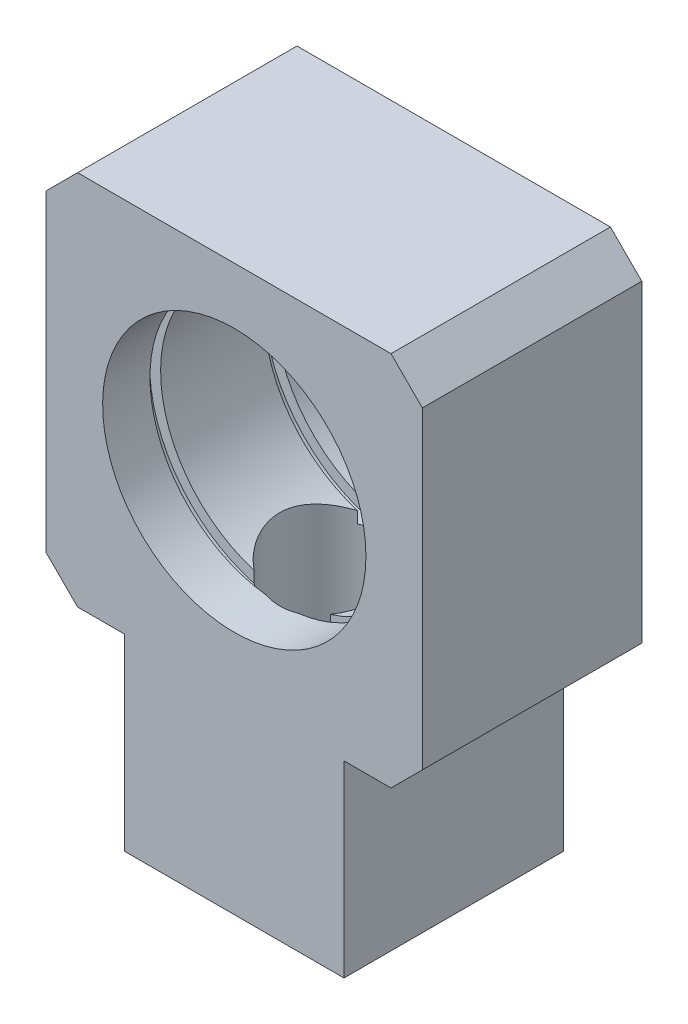
from build123d import *

# Parameters (mm, degrees)
SKETCH_1_R          = 30
SKETCH_1_R_2        = 21
EXTRUDE_1_DEPTH     = 17.5
M22X1_5_1_D         = 20.5
M22X1_5_1_DEPTH     = 48.5
M22X1_5_1_TIP       = 6.158821345
CUT_EXTRUDE_START   = 8.25
SKETCH_5_R          = 22.75
SKETCH_5_R_2        = 21
CUT_EXTRUDE_1_DEPTH = 1.7
CHAMFER_1_SIZE      = 5


with BuildPart() as part:
    # 草图1 → 凸台-拉伸1 (new, symmetric)
    # profile 1 of 8: a face of its own
    with BuildSketch(Plane.XY):
        with BuildLine():
            Line((30, 30), (2.9e-08, 30))
            ThreePointArc((2.9e-08, 30), (21.213203446, 21.213203425), (30, 0))
            Line((30, 0), (30, 30))
        make_face()
    # profile 2 of 8: a face of its own
    with BuildSketch(Plane.XY):
        with BuildLine():
            Line((-30, 30), (-30, 0))
            ThreePointArc((-30, 0), (-21.213203425, 21.213203446), (2.9e-08, 30))
            Line((2.9e-08, 30), (-30, 30))
        make_face()
    # profile 3 of 8: a face of its own
    with BuildSketch(Plane.XY):
        Circle(SKETCH_1_R)
        Circle(SKETCH_1_R_2, mode=Mode.SUBTRACT)
    # profile 4 of 8: a face of its own
    with BuildSketch(Plane.XY):
        with BuildLine():
            Line((17.5, -24.366985862), (17.5, -30))
            Line((17.5, -30), (30, -30))
            Line((30, -30), (30, 0))
            ThreePointArc((30, 0), (26.69269563, -13.693063938), (17.5, -24.366985862))
        make_face()
    # profile 5 of 8: a face of its own
    with BuildSketch(Plane.XY):
        with BuildLine():
            ThreePointArc((17.5, -24.366985862), (9.192127723, -28.557044454), (0, -30))
            Line((0, -30), (17.5, -30))
            Line((17.5, -30), (17.5, -24.366985862))
        make_face()
    # profile 6 of 8: a face of its own
    with BuildSketch(Plane.XY):
        with BuildLine():
            ThreePointArc((0, -30), (-9.192127723, -28.557044454), (-17.5, -24.366985862))
            Line((-17.5, -24.366985862), (-17.5, -30))
            Line((-17.5, -30), (0, -30))
        make_face()
    # profile 7 of 8: a face of its own
    with BuildSketch(Plane.XY):
        with BuildLine():
            Line((-17.5, -30), (-17.5, -24.366985862))
            ThreePointArc((-17.5, -24.366985862), (-26.69269563, -13.693063938), (-30, 0))
            Line((-30, 0), (-30, -30))
            Line((-30, -30), (-17.5, -30))
        make_face()
    # profile 8 of 8: a face of its own
    with BuildSketch(Plane.XY):
        Polygon((0, -30), (-17.5, -30), (-17.5, -60), (17.5, -60), (17.5, -30), align=None)
    extrude(amount=EXTRUDE_1_DEPTH, both=True)

    # M22x1.5 螺纹孔1
    with Locations(Plane.XZ.offset(60)):
        with Locations((0, 0)):
            Hole(M22X1_5_1_D / 2, depth=M22X1_5_1_DEPTH)
            with Locations((0, 0, -(M22X1_5_1_DEPTH + M22X1_5_1_TIP / 2))):  # 118° drill point
                Cone(0, M22X1_5_1_D / 2, M22X1_5_1_TIP, mode=Mode.SUBTRACT)

    # 草图5 → 切除-拉伸1 (cut)
    with BuildSketch(Plane.XY.offset(CUT_EXTRUDE_START)):
        Circle(SKETCH_5_R)
        with Locations(Location((0, 0, 0), (0, 0, 253.16267609))):
            Circle(SKETCH_5_R_2, mode=Mode.SUBTRACT)
    cut_extrude_1 = extrude(amount=CUT_EXTRUDE_1_DEPTH, mode=Mode.SUBTRACT)

    # 镜向1: 切除-拉伸1 across plane
    add(cut_extrude_1.mirror(Plane.XY), mode=Mode.SUBTRACT)

    # 倒角1
    chamfer_1_edges = [part.edges().sort_by_distance(p)[0] for p in [
        (-30, -30, 0),
        (-30, 30, 0),
        (30, 30, 0),
        (30, -30, 0),
    ]]
    chamfer(chamfer_1_edges, length=CHAMFER_1_SIZE)


solid = part.part
